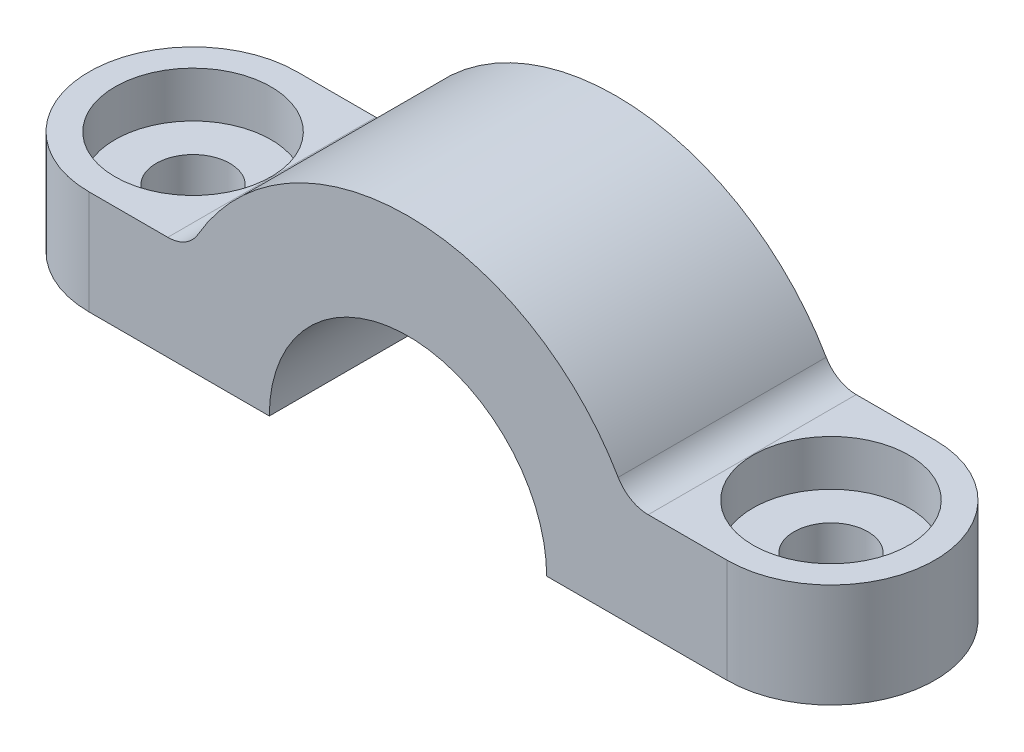
from build123d import *

# Parameters (mm, degrees)
BOSS_EXTRUDE1_DEPTH                                  = 9.525
BOSS_EXTRUDE2_DEPTH                                  = 9.525
FILLET1_R                                            = 3.175
CBORE_FOR_1_4_BINDING_HEAD_MACHINE_SCREW_D           = 6.7564
CBORE_FOR_1_4_BINDING_HEAD_MACHINE_SCREW_CBORE_D     = 14.2875
CBORE_FOR_1_4_BINDING_HEAD_MACHINE_SCREW_CBORE_DEPTH = 4.191


with BuildPart() as part:
    # Sketch1 → Boss-Extrude1 (new, symmetric)
    with BuildSketch(Plane.XY):
        with BuildLine():
            Line((-22.225, 0), (-12.7, 0))
            ThreePointArc((-12.7, 0), (0, 12.7), (12.7, 0))
            Line((12.7, 0), (22.225, 0))
            ThreePointArc((22.225, 0), (0, 22.225), (-22.225, 0))
        make_face()
    extrude(amount=BOSS_EXTRUDE1_DEPTH, both=True)

    # Sketch2 → Boss-Extrude2 (add)
    with BuildSketch(Plane.XZ):
        with BuildLine():
            Line((-12.7, -9.525), (-29.21, -9.525))
            ThreePointArc((-29.21, -9.525), (-38.735, 0), (-29.21, 9.525))
            Line((-29.21, 9.525), (-12.7, 9.525))
            Line((-12.7, 9.525), (-12.7, -9.525))
        make_face()
        with BuildLine():
            Line((12.7, 9.525), (12.7, -9.525))
            Line((12.7, -9.525), (29.21, -9.525))
            ThreePointArc((29.21, -9.525), (38.735, 0), (29.21, 9.525))
            Line((29.21, 9.525), (12.7, 9.525))
        make_face()
    extrude(amount=-BOSS_EXTRUDE2_DEPTH)

    # Fillet1
    fillet1_edges = [part.edges().sort_by_distance(p)[0] for p in [
        (-20.080463142, 9.525, 0),
        (20.080463142, 9.525, 0),
    ]]
    fillet(fillet1_edges, radius=FILLET1_R)

    # CBORE for 1/4 Binding Head Machine Screw1 (through all)
    with Locations(Plane(origin=(0, 9.525, 0), x_dir=(1, 0, 0), z_dir=(0, 1, 0))):
        with Locations((-29.21, 0), (29.21, 0)):
            CounterBoreHole(CBORE_FOR_1_4_BINDING_HEAD_MACHINE_SCREW_D / 2, CBORE_FOR_1_4_BINDING_HEAD_MACHINE_SCREW_CBORE_D / 2, CBORE_FOR_1_4_BINDING_HEAD_MACHINE_SCREW_CBORE_DEPTH)


solid = part.part
